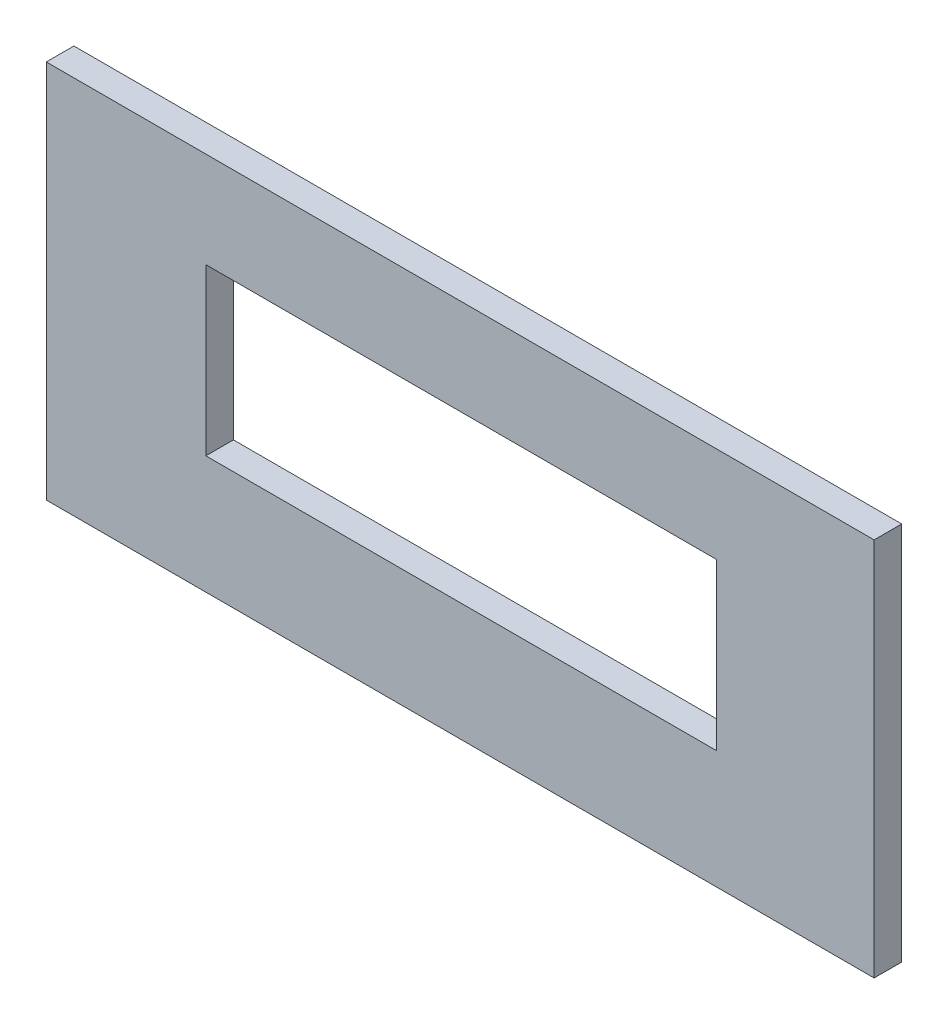
from build123d import *

# Parameters (mm, degrees)
ESQUISSE1_W             = 120
ESQUISSE1_H             = 55
BOSS_EXTRU_1_DEPTH      = 4
ESQUISSE3_W             = 74
ESQUISSE3_H             = 24
ENL_V_MAT_EXTRU_1_DEPTH = 4


with BuildPart() as part:
    # Esquisse1 → Boss.-Extru.1 (new body)
    with BuildSketch(Plane.XY):
        with Locations((-60, -27.5)):
            Rectangle(ESQUISSE1_W, ESQUISSE1_H)
    extrude(amount=BOSS_EXTRU_1_DEPTH)

    # Esquisse3 → Enlèv. mat.-Extru.1 (cut)
    with BuildSketch(Plane.XY.offset(4)):
        with Locations((-59.870685518, -25.883568979)):
            Rectangle(ESQUISSE3_W, ESQUISSE3_H)
    extrude(amount=-ENL_V_MAT_EXTRU_1_DEPTH, mode=Mode.SUBTRACT)


solid = part.part
